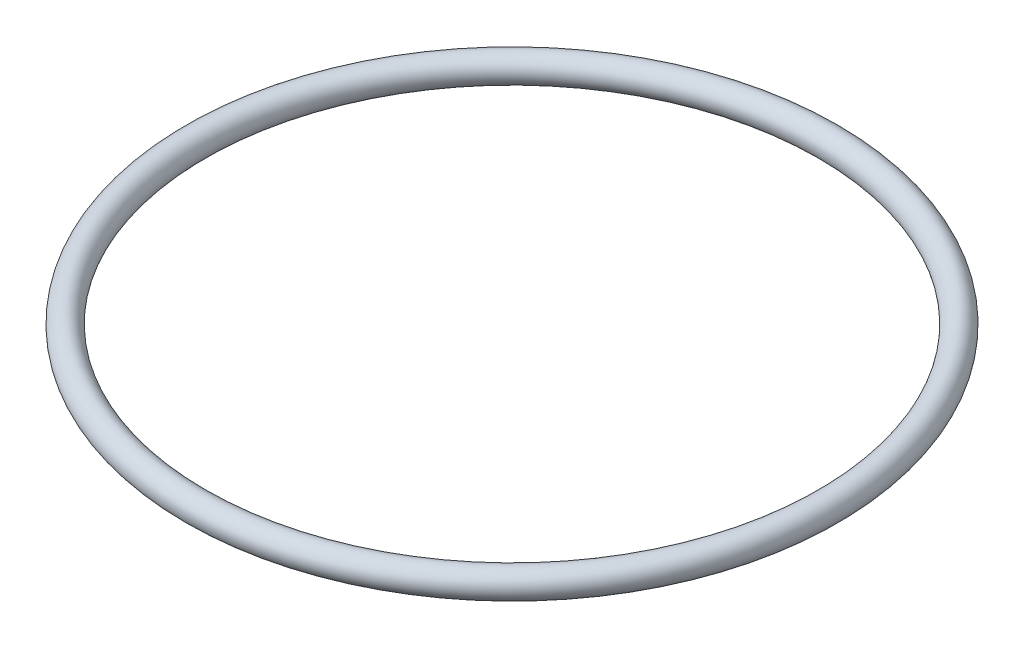
from build123d import *

# Parameters (mm, degrees)
SKETCH1_R = 1.3081


with BuildPart() as part:
    # Sketch1 → Revolve1 (revolve)
    with BuildSketch(Plane.XY, mode=Mode.PRIVATE) as revolve1_sk:
        with Locations((30.5181, 0)):
            Circle(SKETCH1_R)
    revolve(revolve1_sk.sketch.rotate(Axis((0, 0, 0), (0, 1, 0)), 90), axis=Axis((0, 0, 0), (0, 1, 0)))


solid = part.part
